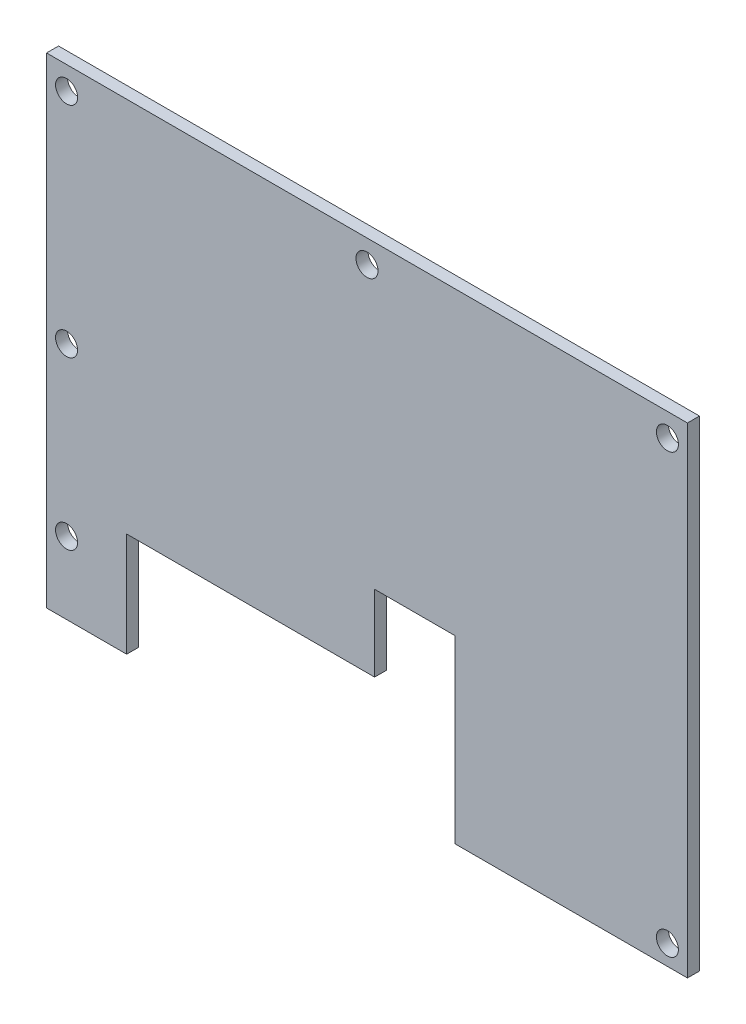
from build123d import *

# Parameters (mm, degrees)
SKETCH1_W            = 160
SKETCH1_H            = 120
BOSS_EXTRUDE1_DEPTH  = 3
SKETCH2_W            = 61.9
SKETCH2_H            = 26
CUT_EXTRUDE1_DEPTH   = 10
M5_CLEARANCE_HOLE1_D = 5.5


with BuildPart() as part:
    # Sketch1 → Boss-Extrude1 (new body)
    with BuildSketch(Plane.XY):
        with Locations((80, 60)):
            Rectangle(SKETCH1_W, SKETCH1_H)
    extrude(amount=BOSS_EXTRUDE1_DEPTH)

    # Sketch2 → Cut-Extrude1 (cut)
    with BuildSketch(Plane.XY.offset(3)):
        Polygon((81.9, 26), (81.9, 0), (102, 0), (102, 45), (81.9, 45), align=None)
        with Locations((50.95, 13)):
            Rectangle(SKETCH2_W, SKETCH2_H)
    extrude(amount=-CUT_EXTRUDE1_DEPTH, mode=Mode.SUBTRACT)

    # M5 Clearance Hole1 (through all)
    with Locations(Plane.XY.offset(3)):
        with Locations((5, 114.23), (155, 5), (155, 114.23), (80, 114.23), (5, 59.615), (5, 18)):
            Hole(M5_CLEARANCE_HOLE1_D / 2)


solid = part.part
